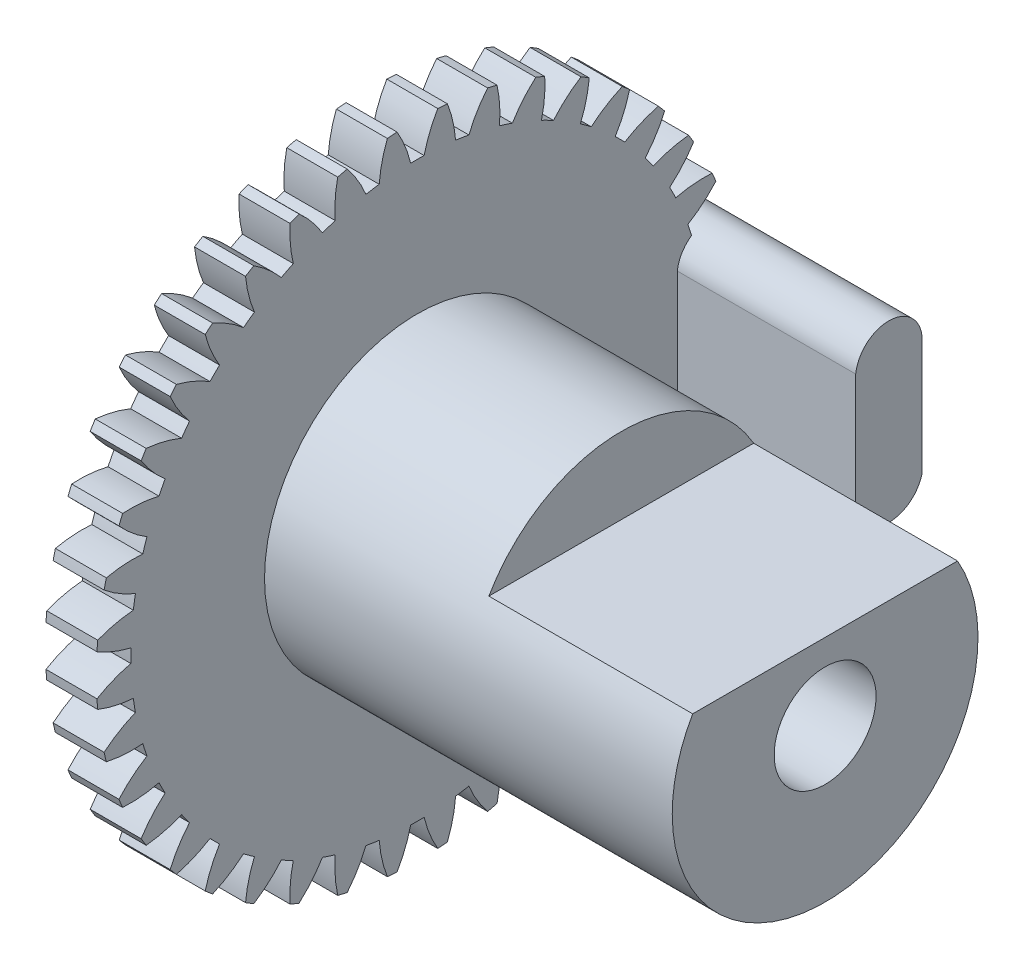
from build123d import *

# Parameters (mm, degrees)
BASPROSKE_W                  = 1
BASPROSKE_H                  = 6.3
TOOTHCUT_DEPTH               = 9.96548939
TEETHCUTS_COUNT              = 40
TEETHCUTS_ANGLE              = 351
BORSKE_R                     = 1
BORE_DEPTH                   = 50.0000508
ESTRUSIONE_ESTRUSIONE1_START = 8
SCHIZZO1_R                   = 3
SCHIZZO1_R_2                 = 1
ESTRUSIONE_ESTRUSIONE1_DEPTH = 8
TAGLIO_ESTRUSIONE1_DEPTH     = 4
ESTRUSIONE_ESTRUSIONE2_START = -1
ESTRUSIONE_ESTRUSIONE2_DEPTH = 4.5


with BuildPart() as part:
    # BasProSke → Base-Revolve (revolve)
    with BuildSketch(Plane(origin=(0, 0, 0), x_dir=(1, 0, 0), z_dir=(0, 1, 0)), mode=Mode.PRIVATE) as base_revolve_sk:
        with Locations((0.5, 3.15)):
            Rectangle(BASPROSKE_W, BASPROSKE_H)
    revolve(base_revolve_sk.sketch.rotate(Axis((-10, 0, 0), (1, 0, 0)), 180), axis=Axis((-10, 0, 0), (1, 0, 0)))

    # TooCutSke → ToothCut (cut, through all)
    with BuildSketch(Plane(origin=(0, 0, 0), x_dir=(0, 0, -1), z_dir=(1, 0, 0))):
        with BuildLine():
            ThreePointArc((0.132139403, 5.622447437), (0, 5.624), (-0.132139403, 5.622447437))
            ThreePointArc((-0.132139403, 5.622447437), (-0.246228658, 5.978143985), (-0.414130153, 6.311828687))
            ThreePointArc((-0.414130153, 6.311828687), (0, 6.3254), (0.414130153, 6.311828687))
            ThreePointArc((0.414130153, 6.311828687), (0.246228658, 5.978143985), (0.132139403, 5.622447437))
        make_face()
    toothcut = extrude(amount=TOOTHCUT_DEPTH, mode=Mode.SUBTRACT)

    # TeethCuts: ToothCut ×40 about axis
    teethcuts_axis = Axis((-10, 0, 0), (1, 0, 0))
    for i in range(1, TEETHCUTS_COUNT):
        add(toothcut.rotate(teethcuts_axis, i * TEETHCUTS_ANGLE / (TEETHCUTS_COUNT - 1)), mode=Mode.SUBTRACT)

    # BorSke → Bore (cut, symmetric)
    with BuildSketch(Plane(origin=(0, 0, 0), x_dir=(0, 0, -1), z_dir=(1, 0, 0))):
        with Locations(Location((0, 0, 0), (0, 0, 180))):
            Circle(BORSKE_R)
    extrude(amount=BORE_DEPTH, both=True, mode=Mode.SUBTRACT)

    # Schizzo1 → Estrusione-Estrusione1 (add)
    with BuildSketch(Plane(origin=(1, 0, 0), x_dir=(0, 0, -1), z_dir=(1, 0, 0)).offset(ESTRUSIONE_ESTRUSIONE1_START)):
        with Locations(Location((0, 0, 0), (0, 0, 180))):
            Circle(SCHIZZO1_R)
        Circle(SCHIZZO1_R_2, mode=Mode.SUBTRACT)
    extrude(amount=-ESTRUSIONE_ESTRUSIONE1_DEPTH)

    # Schizzo2 → Taglio-Estrusione1 (cut)
    with BuildSketch(Plane(origin=(9, 0, 0), x_dir=(0, 0, -1), z_dir=(1, 0, 0))):
        with BuildLine():
            Line((-2.598076211, 1.5), (2.598076211, 1.5))
            ThreePointArc((2.598076211, 1.5), (0, 3), (-2.598076211, 1.5))
        make_face()
    extrude(amount=-TAGLIO_ESTRUSIONE1_DEPTH, mode=Mode.SUBTRACT)

    # Schizzo3 → Estrusione-Estrusione2 (add)
    with BuildSketch(Plane(origin=(1, 0, 0), x_dir=(0, 0, -1), z_dir=(1, 0, 0)).offset(ESTRUSIONE_ESTRUSIONE2_START)):
        with BuildLine():
            Line((6.4, 1.175248818), (6.4, -1.175248818))
            ThreePointArc((6.4, -1.175248818), (5.75, -1.67321033), (5.1, -1.175248818))
            Line((5.1, -1.175248818), (5.1, 1.175248818))
            ThreePointArc((5.1, 1.175248818), (5.75, 1.754341184), (6.4, 1.175248818))
        make_face()
    extrude(amount=ESTRUSIONE_ESTRUSIONE2_DEPTH)


solid = part.part
